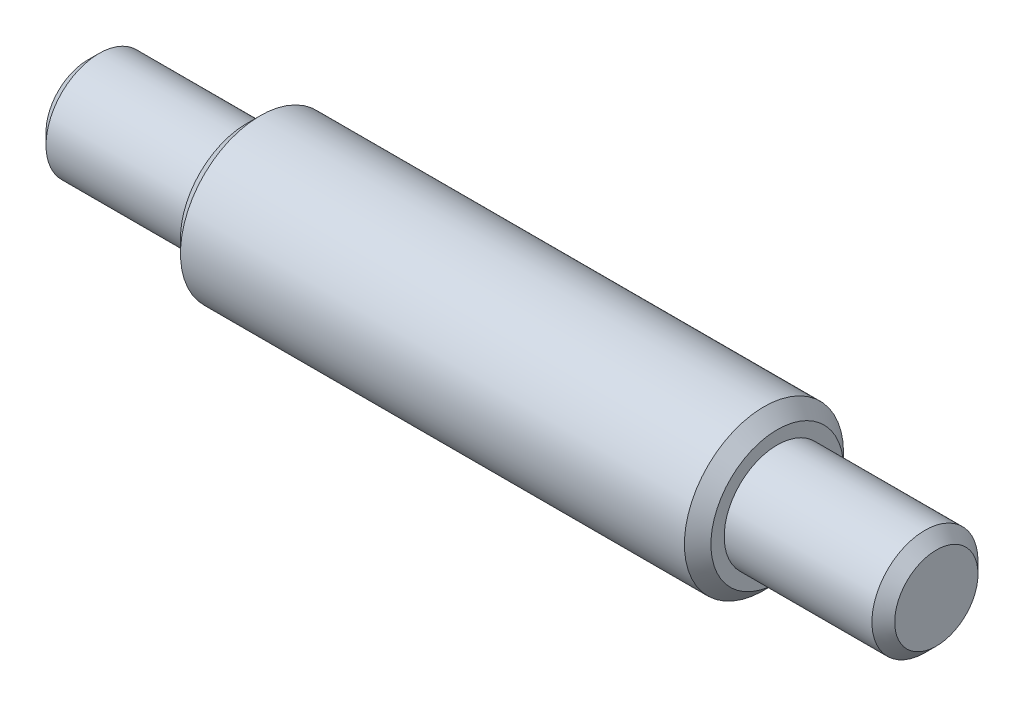
from build123d import *


with BuildPart() as part:
    # Sketch1 → Revolve1 (revolve)
    with BuildSketch(Plane.XY, mode=Mode.PRIVATE) as revolve1_sk:
        Polygon((-6, 1.5705), (-6, 0), (26, 0), (26, 1.5705), (25.5705, 2), (20, 2), (20, 2.5), (19.5, 3), (0.5, 3), (0, 2.5), (0, 2), (-5.5705, 2), align=None)
    revolve(revolve1_sk.sketch.rotate(Axis((-6, 0, 0), (1, 0, 0)), 270), axis=Axis((-6, 0, 0), (1, 0, 0)))


solid = part.part
